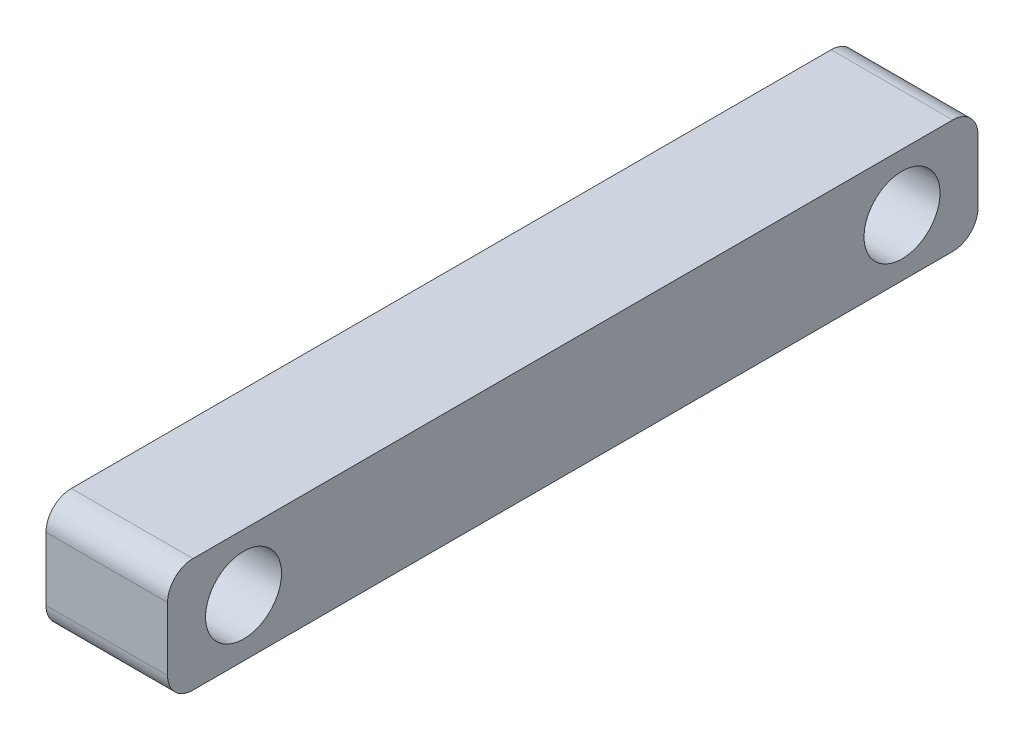
from build123d import *

# Parameters (mm, degrees)
SALIENTE_EXTRUIR1_DEPTH    = 2.4
CORTAR_EXTRUIR1_DEPTH      = 17.334702324
CORTAR_EXTRUIR1_DEPTH_BACK = 17.334702324
CROQUIS2_R                 = 1.5


with BuildPart() as part:
    # Croquis1 → Saliente-Extruir1 (new, symmetric)
    with BuildSketch(Plane(origin=(0, 0, 0), x_dir=(0, 0, -1), z_dir=(1, 0, 0))):
        with BuildLine():
            Line((-15, 2.25), (15, 2.25))
            ThreePointArc((15, 2.25), (15.707106781, 1.957106781), (16, 1.25))
            Line((16, 1.25), (16, -1.25))
            ThreePointArc((16, -1.25), (15.707106781, -1.957106781), (15, -2.25))
            Line((15, -2.25), (-15, -2.25))
            ThreePointArc((-15, -2.25), (-15.707106781, -1.957106781), (-16, -1.25))
            Line((-16, -1.25), (-16, 1.25))
            ThreePointArc((-16, 1.25), (-15.707106781, 1.957106781), (-15, 2.25))
        make_face()
    extrude(amount=SALIENTE_EXTRUIR1_DEPTH, both=True)

    # Croquis2 → Cortar-Extruir1 (cut, two sides: drawn at the far end of the back side and taken through both)
    with BuildSketch(Plane(origin=(0, 0, 0), x_dir=(0, 0, -1), z_dir=(1, 0, 0)).offset(-CORTAR_EXTRUIR1_DEPTH_BACK)):
        with Locations((-13, 0)):
            Circle(CROQUIS2_R)
        with Locations((13, 0)):
            Circle(CROQUIS2_R)
    extrude(amount=CORTAR_EXTRUIR1_DEPTH + CORTAR_EXTRUIR1_DEPTH_BACK, mode=Mode.SUBTRACT)


solid = part.part
